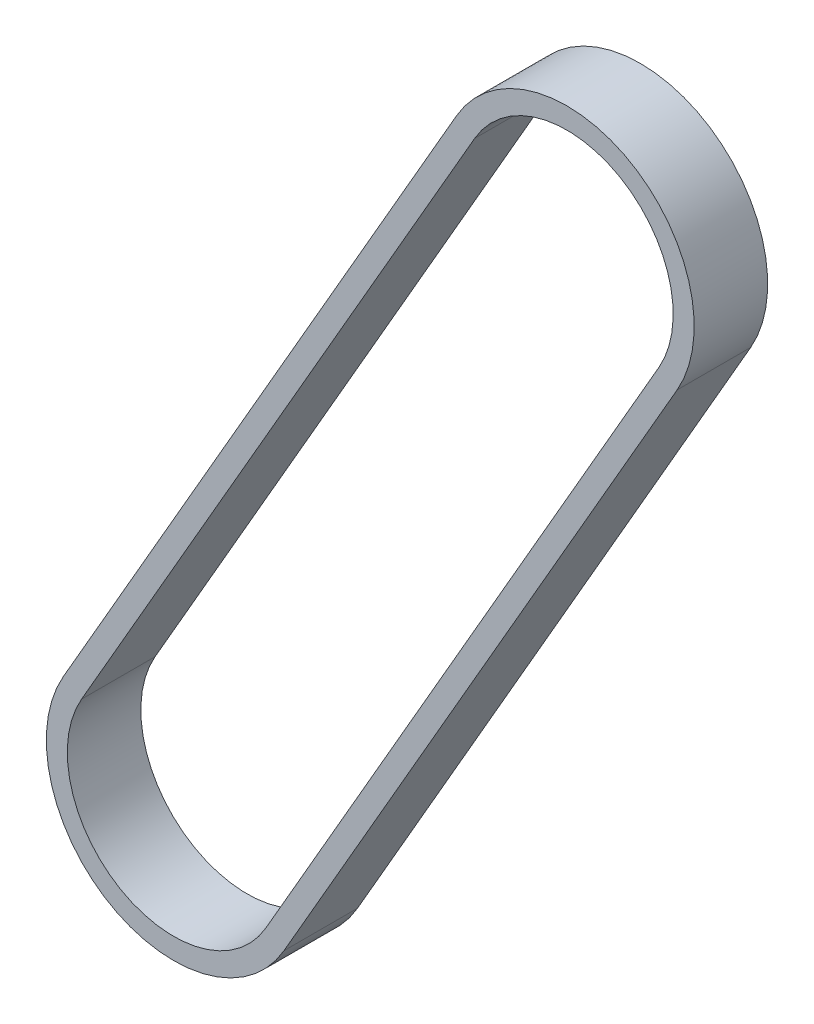
from build123d import *

# Parameters (mm, degrees)
EXTRUDE_1_DEPTH = 3.5


with BuildPart() as part:
    # 草图2 → 拉伸-薄壁1 (new, symmetric)
    with BuildSketch(Plane.XY):
        with BuildLine():
            Line((-74.961135512, -26.92842507), (-37.512047152, 38.052847471))
            ThreePointArc((-37.512047152, 38.052847471), (-20.95247214, 42.503883914), (-16.501435697, 25.944308902))
            Line((-16.501435697, 25.944308902), (-53.950524057, -39.036963639))
            ThreePointArc((-53.950524057, -39.036963639), (-70.510099069, -43.488000082), (-74.961135512, -26.92842507))
        make_face()
        with BuildLine():
            Line((-73.228301577, -27.927067426), (-35.779213218, 37.054205115))
            ThreePointArc((-35.779213218, 37.054205115), (-21.951114496, 40.77104998), (-18.234269632, 26.942951258))
            Line((-18.234269632, 26.942951258), (-55.683357991, -38.038321283))
            ThreePointArc((-55.683357991, -38.038321283), (-69.511456713, -41.755166147), (-73.228301577, -27.927067426))
        make_face(mode=Mode.SUBTRACT)
    extrude(amount=EXTRUDE_1_DEPTH, both=True)


solid = part.part
